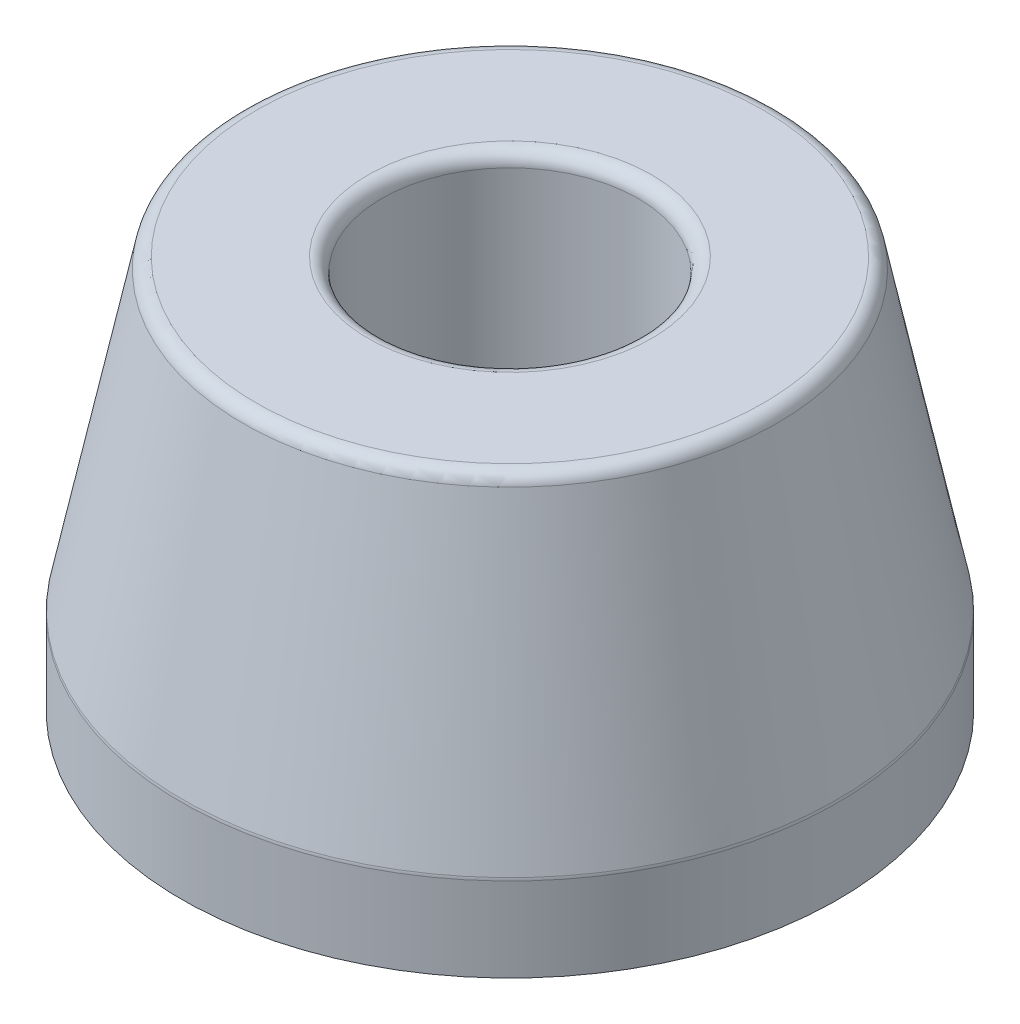
from build123d import *


with BuildPart() as part:
    # Sketch1 → Revolve1 (revolve)
    with BuildSketch(Plane.XY, mode=Mode.PRIVATE) as revolve1_sk:
        with BuildLine():
            Line((4.7625, 0), (4.7625, 14.097))
            ThreePointArc((4.7625, 14.097), (4.911289755, 14.456210245), (5.2705, 14.605))
            Line((5.2705, 14.605), (9.428300973, 14.605))
            ThreePointArc((9.428300973, 14.605), (9.749318022, 14.490715702), (9.925897244, 14.199283678))
            Line((9.925897244, 14.199283678), (12.181596271, 3.225612734))
            ThreePointArc((12.181596271, 3.225612734), (12.189392375, 3.174734767), (12.192, 3.123329056))
            Line((12.192, 3.123329056), (12.192, 0))
            Line((12.192, 0), (4.7625, 0))
        make_face()
    revolve(revolve1_sk.sketch.rotate(Axis((0, 0, 0), (0, 1, 0)), 90), axis=Axis((0, 0, 0), (0, 1, 0)))


solid = part.part
